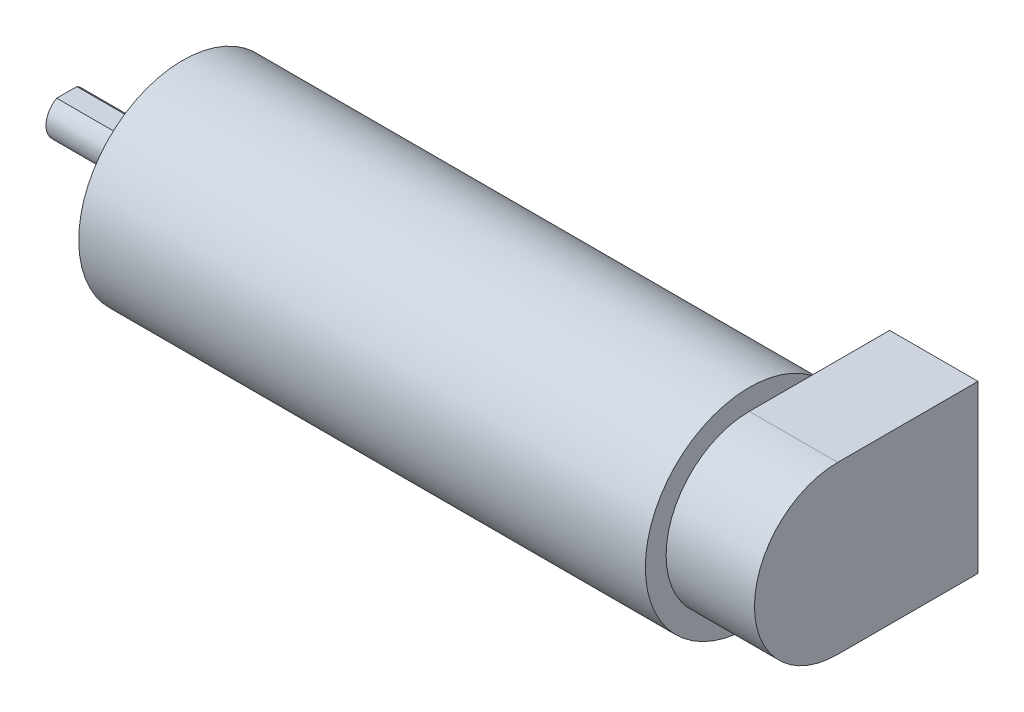
from build123d import *

# Parameters (mm, degrees)
SKETCH_2_R          = 20
EXTRUDE_1_DEPTH     = 109
EXTRUDE_2_DEPTH     = 17
SKETCH_5_R          = 12.5
EXTRUDE_3_DEPTH     = 3.3
SKETCH_6_R          = 4
EXTRUDE_4_DEPTH     = 19
CUT_EXTRUDE_START   = -15
CUT_EXTRUDE_1_DEPTH = 15


with BuildPart() as part:
    # 草图2 → 凸台-拉伸1 (new body)
    with BuildSketch(Plane(origin=(0, 0, 0), x_dir=(0, 0, -1), z_dir=(1, 0, 0))):
        Circle(SKETCH_2_R)
    extrude(amount=EXTRUDE_1_DEPTH)

    # 草图4 → 凸台-拉伸2 (add)
    with BuildSketch(Plane(origin=(109, 0, 0), x_dir=(0, 0, -1), z_dir=(1, 0, 0))):
        with BuildLine():
            Line((0, 16), (27, 16))
            Line((27, 16), (27, -16))
            Line((27, -16), (0, -16))
            ThreePointArc((0, -16), (-16, 0), (0, 16))
        make_face()
    extrude(amount=EXTRUDE_2_DEPTH)

    # 草图5 → 凸台-拉伸3 (add)
    with BuildSketch(Plane.ZY):
        with Locations(Location((0, 0, 0), (0, 0, 180))):
            Circle(SKETCH_5_R)
    extrude(amount=EXTRUDE_3_DEPTH)

    # 草图6 → 凸台-拉伸4 (add)
    with BuildSketch(Plane.ZY.offset(3.3)):
        with Locations(Location((0, 0, 0), (0, 0, 180))):
            Circle(SKETCH_6_R)
    extrude(amount=EXTRUDE_4_DEPTH)

    # 草图7 → 切除-拉伸1 (cut)
    with BuildSketch(Plane.ZY.offset(22.3).offset(CUT_EXTRUDE_START)):
        with BuildLine():
            Line((-1.936491673, 3.5), (1.936491673, 3.5))
            ThreePointArc((1.936491673, 3.5), (0, 4), (-1.936491673, 3.5))
        make_face()
    extrude(amount=CUT_EXTRUDE_1_DEPTH, mode=Mode.SUBTRACT)


solid = part.part
